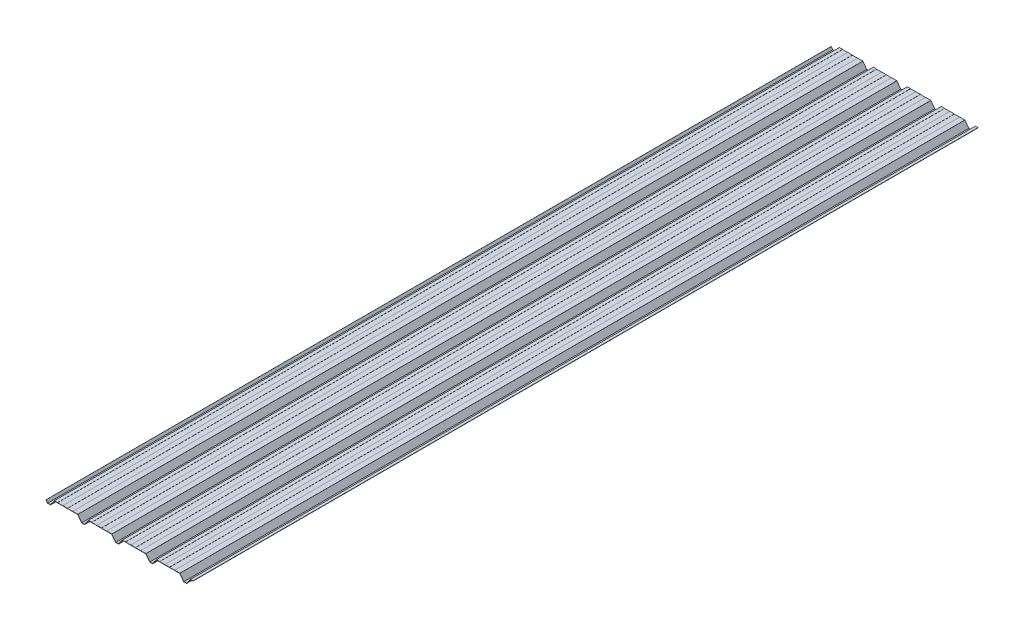
from build123d import *

# Parameters (mm, degrees)
BOSS_EXTRUDE1_DEPTH = 6000
SKETCH2_W           = 40
SKETCH2_H           = 6000
CUT_EXTRUDE1_DEPTH  = 0.5
SKETCH2_9_W         = 40
SKETCH2_9_H         = 6000
SKETCH2_9_W_2       = 35
SKETCH2_9_W_3       = 25
BOSS_EXTRUDE3_DEPTH = 0.5
LPATTERN1_COUNT     = 4
LPATTERN1_PITCH     = 260


with BuildPart() as part:
    # Sketch1 → Boss-Extrude1 (new body)
    with BuildSketch(Plane.XY):
        Polygon((-20, 0), (0, 0), (0, -2), (-19, -2), (-49, -42), (-71, -42), (-101, -2), (-279, -2), (-309, -42), (-331, -42), (-361, -2), (-539, -2), (-569, -42), (-591, -42), (-621, -2), (-799, -2), (-829, -42), (-851, -42), (-881, -2), (-1059, -2), (-1089, -42), (-1111, -42), (-1123.6, -25.2), (-1122, -24), (-1110, -40), (-1090, -40), (-1060, 0), (-880, 0), (-850, -40), (-830, -40), (-800, 0), (-620, 0), (-590, -40), (-570, -40), (-540, 0), (-360, 0), (-330, -40), (-310, -40), (-280, 0), (-100, 0), (-70, -40), (-50, -40), align=None)
    extrude(amount=-BOSS_EXTRUDE1_DEPTH)

    # Sketch2 → Cut-Extrude1 (cut)
    with BuildSketch(Plane(origin=(0, 0, 0), x_dir=(1, 0, 0), z_dir=(0, 1, 0))):
        with Locations((-160, 3000)):
            Rectangle(SKETCH2_W, SKETCH2_H)
        with Locations((-235, 3000)):
            Rectangle(SKETCH2_W, SKETCH2_H)
    cut_extrude1 = extrude(amount=-CUT_EXTRUDE1_DEPTH, mode=Mode.SUBTRACT)

    # Sketch2<9> → Boss-Extrude3 (add)
    with BuildSketch(Plane(origin=(0, 0, 0), x_dir=(1, 0, 0), z_dir=(0, 1, 0))):
        with Locations((-120, 3000)):
            Rectangle(SKETCH2_9_W, SKETCH2_9_H)
        with Locations((-197.5, 3000)):
            Rectangle(SKETCH2_9_W_2, SKETCH2_9_H)
        with Locations((-267.5, 3000)):
            Rectangle(SKETCH2_9_W_3, SKETCH2_9_H)
    boss_extrude3 = extrude(amount=BOSS_EXTRUDE3_DEPTH)

    # LPattern1: Cut-Extrude1, Boss-Extrude3 ×4
    with Locations(*[(-i * LPATTERN1_PITCH, 0, 0) for i in range(1, LPATTERN1_COUNT)]):
        add(cut_extrude1, mode=Mode.SUBTRACT)
        add(boss_extrude3)


solid = part.part
